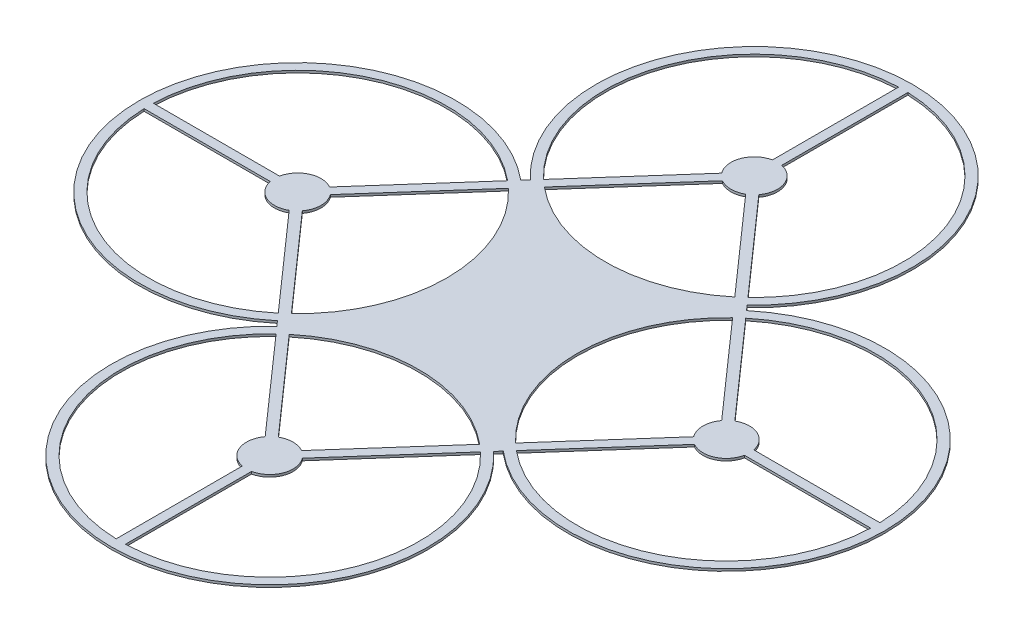
from build123d import *

# Parameters (mm, degrees)
BOSS_EXTRUDE2_DEPTH = 1.5748


with BuildPart() as part:
    # Sketch1 → Boss-Extrude2 (new body)
    with BuildSketch(Plane(origin=(0, 0, 0), x_dir=(1, 0, 0), z_dir=(0, 1, 0))):
        with BuildLine():
            ThreePointArc((105.621971622, 137.184472252), (31.75, 323.85), (-42.121971622, 137.184472252))
            Line((-42.121971622, 137.184472252), (-45.184156549, 133.7228719))
            ThreePointArc((-45.184156549, 133.7228719), (-222.25, 50.8), (-45.184156549, -32.1228719))
            Line((-45.184156549, -32.1228719), (-42.121971622, -35.584472252))
            ThreePointArc((-42.121971622, -35.584472252), (31.75, -222.25), (105.621971622, -35.584472252))
            Line((105.621971622, -35.584472252), (108.684156549, -32.1228719))
            ThreePointArc((108.684156549, -32.1228719), (285.75, 50.8), (108.684156549, 133.7228719))
            Line((108.684156549, 133.7228719), (105.621971622, 137.184472252))
        make_face()
        with BuildLine():
            ThreePointArc((19.066089569, -104.753584904), (16.904555213, -119.923912703), (28.575, -129.854259867))
            Line((28.575, -129.854259867), (28.575, -215.850378507))
            ThreePointArc((28.575, -215.850378507), (-63.260846634, -150.293041299), (-37.912692613, -40.342787654))
            Line((-37.912692613, -40.342787654), (19.066089569, -104.753584904))
        make_face(mode=Mode.SUBTRACT)
        with BuildLine():
            Line((-215.850378507, 47.625), (-129.854259867, 47.625))
            ThreePointArc((-129.854259867, 47.625), (-120.820607869, 36.325978513), (-106.372217741, 37.046240752))
            Line((-106.372217741, 37.046240752), (-49.393435559, -27.364556498))
            ThreePointArc((-49.393435559, -27.364556498), (-156.031890363, -41.833737519), (-215.850378507, 47.625))
        make_face(mode=Mode.SUBTRACT)
        with BuildLine():
            Line((-101.616089569, 60.346415096), (-44.637307387, 124.757212346))
            ThreePointArc((-44.637307387, 124.757212346), (-12.7, 50.8), (-44.637307387, -23.157212346))
            Line((-44.637307387, -23.157212346), (-101.616089569, 41.253584904))
            ThreePointArc((-101.616089569, 41.253584904), (-98.425, 50.8), (-101.616089569, 60.346415096))
        make_face(mode=Mode.SUBTRACT)
        with BuildLine():
            Line((44.433910431, -104.753584904), (101.412692613, -40.342787654))
            ThreePointArc((101.412692613, -40.342787654), (126.760846634, -150.293041299), (34.925, -215.850378507))
            Line((34.925, -215.850378507), (34.925, -129.854259867))
            ThreePointArc((34.925, -129.854259867), (46.595444787, -119.923912703), (44.433910431, -104.753584904))
        make_face(mode=Mode.SUBTRACT)
        with BuildLine():
            ThreePointArc((-33.156564441, -36.135443502), (31.75, -12.7), (96.656564441, -36.135443502))
            Line((96.656564441, -36.135443502), (39.677782259, -100.546240752))
            ThreePointArc((39.677782259, -100.546240752), (31.75, -98.425), (23.822217741, -100.546240752))
            Line((23.822217741, -100.546240752), (-33.156564441, -36.135443502))
        make_face(mode=Mode.SUBTRACT)
        with BuildLine():
            ThreePointArc((108.137307387, -23.157212346), (76.2, 50.8), (108.137307387, 124.757212346))
            Line((108.137307387, 124.757212346), (165.116089569, 60.346415096))
            ThreePointArc((165.116089569, 60.346415096), (161.925, 50.8), (165.116089569, 41.253584904))
            Line((165.116089569, 41.253584904), (108.137307387, -23.157212346))
        make_face(mode=Mode.SUBTRACT)
        with BuildLine():
            ThreePointArc((169.872217741, 37.046240752), (184.320607869, 36.325978513), (193.354259867, 47.625))
            Line((193.354259867, 47.625), (279.350378507, 47.625))
            ThreePointArc((279.350378507, 47.625), (219.531890363, -41.833737519), (112.893435559, -27.364556498))
            Line((112.893435559, -27.364556498), (169.872217741, 37.046240752))
        make_face(mode=Mode.SUBTRACT)
        with BuildLine():
            ThreePointArc((-215.850378507, 53.975), (-156.031890363, 143.433737519), (-49.393435559, 128.964556498))
            Line((-49.393435559, 128.964556498), (-106.372217741, 64.553759248))
            ThreePointArc((-106.372217741, 64.553759248), (-120.820607869, 65.274021487), (-129.854259867, 53.975))
            Line((-129.854259867, 53.975), (-215.850378507, 53.975))
        make_face(mode=Mode.SUBTRACT)
        with BuildLine():
            Line((28.575, 317.450378507), (28.575, 231.454259867))
            ThreePointArc((28.575, 231.454259867), (16.904555213, 221.523912703), (19.066089569, 206.353584904))
            Line((19.066089569, 206.353584904), (-37.912692613, 141.942787654))
            ThreePointArc((-37.912692613, 141.942787654), (-63.260846634, 251.893041299), (28.575, 317.450378507))
        make_face(mode=Mode.SUBTRACT)
        with BuildLine():
            Line((-33.156564441, 137.735443502), (23.822217741, 202.146240752))
            ThreePointArc((23.822217741, 202.146240752), (31.75, 200.025), (39.677782259, 202.146240752))
            Line((39.677782259, 202.146240752), (96.656564441, 137.735443502))
            ThreePointArc((96.656564441, 137.735443502), (31.75, 114.3), (-33.156564441, 137.735443502))
        make_face(mode=Mode.SUBTRACT)
        with BuildLine():
            Line((279.350378507, 53.975), (193.354259867, 53.975))
            ThreePointArc((193.354259867, 53.975), (184.320607869, 65.274021487), (169.872217741, 64.553759248))
            Line((169.872217741, 64.553759248), (112.893435559, 128.964556498))
            ThreePointArc((112.893435559, 128.964556498), (219.531890363, 143.433737519), (279.350378507, 53.975))
        make_face(mode=Mode.SUBTRACT)
        with BuildLine():
            ThreePointArc((44.433910431, 206.353584904), (46.595444787, 221.523912703), (34.925, 231.454259867))
            Line((34.925, 231.454259867), (34.925, 317.450378507))
            ThreePointArc((34.925, 317.450378507), (126.760846634, 251.893041299), (101.412692613, 141.942787654))
            Line((101.412692613, 141.942787654), (44.433910431, 206.353584904))
        make_face(mode=Mode.SUBTRACT)
    extrude(amount=BOSS_EXTRUDE2_DEPTH)


solid = part.part
